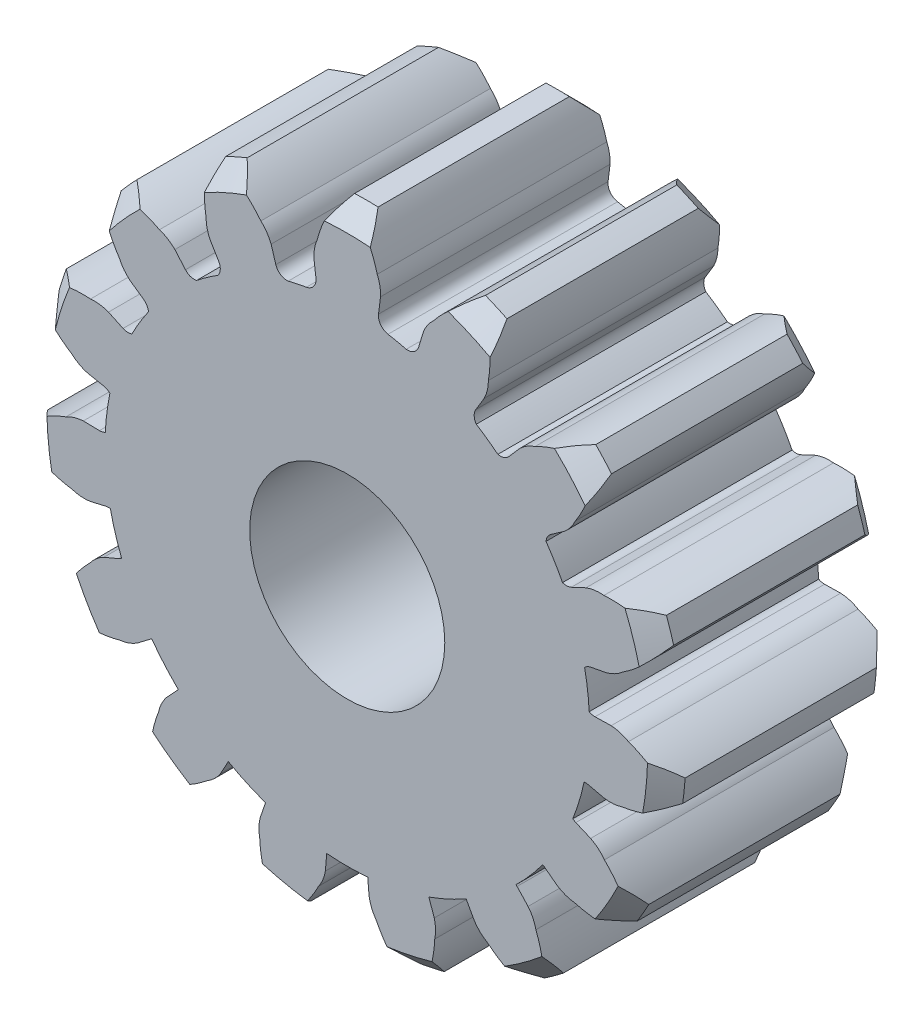
from build123d import *

# Parameters (mm, degrees)
SKETCH1_R                    = 6.333
BOSS_EXTRUDE1_DEPTH          = 6
BOSS_EXTRUDE2_DEPTH          = 6
CHAMFER1_SIZE                = 0.5
CIRPATTERN2_COUNT            = 15
CHAMFER1_OF_CIRPATTERN2_SIZE = 0.5
SKETCH4_R                    = 2.55
CUT_EXTRUDE2_DEPTH           = 14.329472676
CUT_EXTRUDE3_START           = 2
SKETCH5_R                    = 2.55
CUT_EXTRUDE3_DEPTH           = 2


with BuildPart() as part:
    # Sketch1 → Boss-Extrude1 (new body)
    with BuildSketch(Plane.XY):
        Circle(SKETCH1_R)
    extrude(amount=BOSS_EXTRUDE1_DEPTH)

    # Sketch2 → Boss-Extrude2 (add, through all)
    with BuildSketch(Plane.XY.offset(6)):
        with BuildLine():
            Line((0.818172971, 6.575506215), (0.870215599, 6.993763277))
            ThreePointArc((0.870215599, 6.993763277), (0.854599961, 7.231367452), (0.784320818, 7.458876648))
            ThreePointArc((0.784320818, 7.458876648), (0.591900054, 7.998046787), (0.306765812, 8.494462593))
            ThreePointArc((0.306765812, 8.494462593), (0, 8.5), (-0.306765812, 8.494462593))
            ThreePointArc((-0.306765812, 8.494462593), (-0.591900054, 7.998046787), (-0.784320818, 7.458876648))
            ThreePointArc((-0.784320818, 7.458876648), (-0.854599961, 7.231367452), (-0.870215599, 6.993763277))
            Line((-0.870215599, 6.993763277), (-0.818172971, 6.575506215))
            ThreePointArc((-0.818172971, 6.575506215), (-0.875066837, 6.359549324), (-1.065407921, 6.24273938))
            ThreePointArc((-1.065407921, 6.24273938), (0, 6.333), (1.065407921, 6.24273938))
            ThreePointArc((1.065407921, 6.24273938), (0.875066837, 6.359549324), (0.818172971, 6.575506215))
        make_face()
    boss_extrude2 = extrude(amount=-BOSS_EXTRUDE2_DEPTH)

    # Chamfer1
    chamfer1_edges = [part.edges().sort_by_distance(p)[0] for p in [
        (0, 8.5, 0),
        (0, 8.5, 6),
    ]]
    chamfer(chamfer1_edges, length=CHAMFER1_SIZE)

    # CirPattern2: Boss-Extrude2 ×15 about axis
    cirpattern2_axis = Axis((0, 0.14865231, 0), (0, 0, 1))
    for i in range(1, CIRPATTERN2_COUNT):
        add(boss_extrude2.rotate(cirpattern2_axis, i * 360 / CIRPATTERN2_COUNT))

    # Chamfer1 of CirPattern2
    chamfer1_of_cirpattern2_edges = [part.edges().sort_by_distance(p)[0] for p in [
        (-3.396799125, 7.777988057, 0),
        (-3.396799125, 7.777988057, 6),
        (-6.206260821, 5.736794654, 0),
        (-6.206260821, 5.736794654, 6),
        (-7.94260364, 2.729360672, 0),
        (-7.94260364, 2.729360672, 6),
        (-8.305598133, -0.72430123, 0),
        (-8.305598133, -0.72430123, 6),
        (-7.232479255, -4.027021535, 0),
        (-7.232479255, -4.027021535, 6),
        (-4.908799009, -6.607729897, 0),
        (-4.908799009, -6.607729897, 6),
        (-1.736342819, -8.020198396, 0),
        (-1.736342819, -8.020198396, 6),
        (1.736342819, -8.020198396, 0),
        (1.736342819, -8.020198396, 6),
        (4.908799009, -6.607729897, 0),
        (4.908799009, -6.607729897, 6),
        (7.232479255, -4.027021535, 0),
        (7.232479255, -4.027021535, 6),
        (8.305598133, -0.72430123, 0),
        (8.305598133, -0.72430123, 6),
        (7.94260364, 2.729360672, 0),
        (7.94260364, 2.729360672, 6),
        (6.206260821, 5.736794654, 0),
        (6.206260821, 5.736794654, 6),
        (3.396799125, 7.777988057, 0),
        (3.396799125, 7.777988057, 6),
    ]]
    chamfer(chamfer1_of_cirpattern2_edges, length=CHAMFER1_OF_CIRPATTERN2_SIZE)

    # Sketch4 → Cut-Extrude2 (cut, through all)
    with BuildSketch(Plane.XY.offset(6)):
        Circle(SKETCH4_R)
    extrude(amount=-CUT_EXTRUDE2_DEPTH, mode=Mode.SUBTRACT)

    # Sketch5 → Cut-Extrude3 (cut)
    with BuildSketch(Plane.XY.offset(CUT_EXTRUDE3_START)):
        Polygon((0, 5.484827557), (-4.75, 2.742413779), (-4.75, -2.742413779), (0, -5.484827557), (4.75, -2.742413779), (4.75, 2.742413779), align=None)
        Circle(SKETCH5_R, mode=Mode.SUBTRACT)
    extrude(amount=-CUT_EXTRUDE3_DEPTH, mode=Mode.SUBTRACT)


solid = part.part
